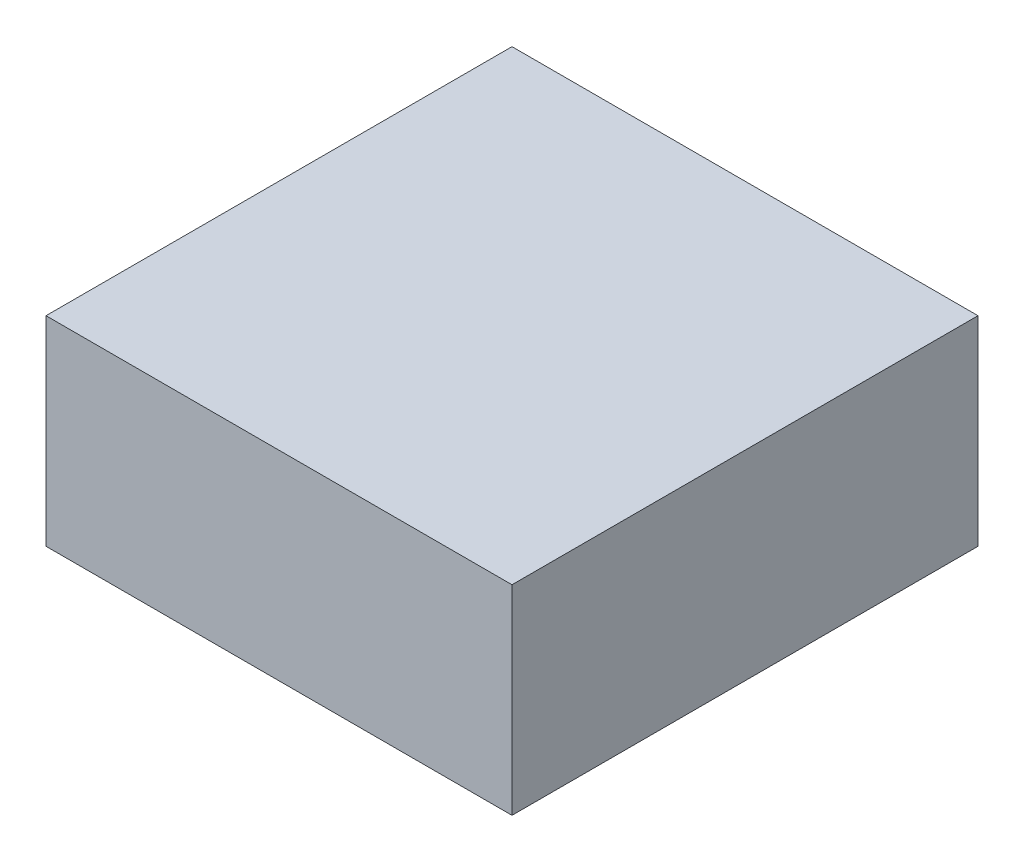
from build123d import *

# Parameters (mm, degrees)
SKETCH1_W           = 177.8
SKETCH1_H           = 76.2
BOSS_EXTRUDE1_DEPTH = 177.8


with BuildPart() as part:
    # Sketch1 → Boss-Extrude1 (new body)
    with BuildSketch(Plane.XY):
        with Locations((88.9, 38.1)):
            Rectangle(SKETCH1_W, SKETCH1_H)
    extrude(amount=BOSS_EXTRUDE1_DEPTH)


solid = part.part
